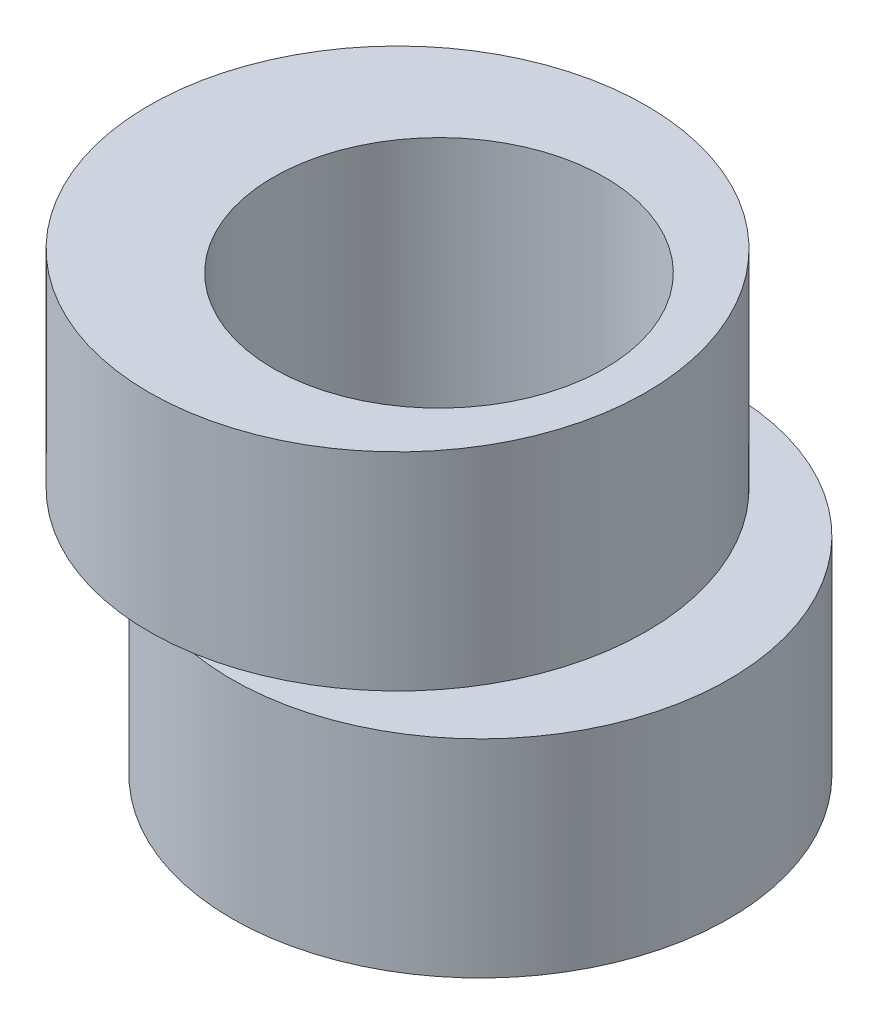
from build123d import *

# Parameters (mm, degrees)
SKETCH1_R           = 6
SKETCH1_R_2         = 4
BOSS_EXTRUDE1_DEPTH = 5
SKETCH2_R           = 6
SKETCH2_R_2         = 4
BOSS_EXTRUDE2_DEPTH = 5


with BuildPart() as part:
    # Sketch1 → Boss-Extrude1 (new body)
    with BuildSketch(Plane(origin=(0, 0, 0), x_dir=(1, 0, 0), z_dir=(0, 1, 0))):
        with Locations(Location((1, 0, 0), (0, 0, 270))):
            Circle(SKETCH1_R)
        with Locations(Location((0, 0, 0), (0, 0, 270))):
            Circle(SKETCH1_R_2, mode=Mode.SUBTRACT)
    extrude(amount=BOSS_EXTRUDE1_DEPTH)

    # Sketch2 → Boss-Extrude2 (add)
    with BuildSketch(Plane(origin=(0, 5, 0), x_dir=(1, 0, 0), z_dir=(0, 1, 0))):
        with Locations(Location((-1, 0, 0), (0, 0, 80.405931773))):
            Circle(SKETCH2_R)
        with Locations(Location((0, 0, 0), (0, 0, 270))):
            Circle(SKETCH2_R_2, mode=Mode.SUBTRACT)
    extrude(amount=BOSS_EXTRUDE2_DEPTH)


solid = part.part
